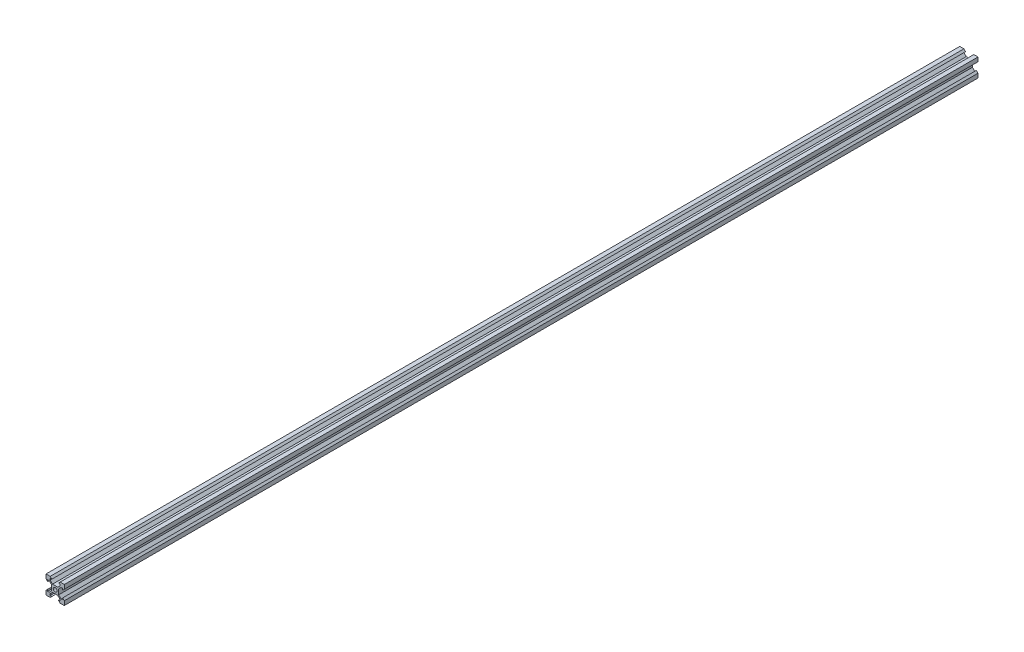
from build123d import *

# Parameters (mm, degrees)
BOSS_EXTRUDE1_DEPTH = 500
SKETCH2_R           = 2.1
CUT_EXTRUDE1_DEPTH  = 1001.099995


with BuildPart() as part:
    # Sketch1 → Boss-Extrude1 (new, symmetric)
    with BuildSketch(Plane.XY):
        Polygon((5.42, -10), (10, -10), (10, -5.42), (8.2, -3.62), (8.2, -5.5), (6.5606, -5.5), (3.9, -2.8394), (3.9, 0), (3.9, 2.8394), (6.5606, 5.5), (8.2, 5.5), (8.2, 3.62), (10, 5.42), (10, 10), (5.42, 10), (3.62, 8.2), (5.5, 8.2), (5.5, 6.5606), (2.8394, 3.9), (-2.8394, 3.9), (-5.5, 6.5606), (-5.5, 8.2), (-3.62, 8.2), (-5.42, 10), (-10, 10), (-10, 5.42), (-8.2, 3.62), (-8.2, 5.5), (-6.5606, 5.5), (-3.9, 2.8394), (-3.9, 0), (-3.9, -2.8394), (-6.5606, -5.5), (-8.2, -5.5), (-8.2, -3.62), (-10, -5.42), (-10, -10), (-5.42, -10), (-3.62, -8.2), (-5.5, -8.2), (-5.5, -6.5606), (-2.8394, -3.9), (2.8394, -3.9), (5.5, -6.5606), (5.5, -8.2), (3.62, -8.2), align=None)
    extrude(amount=BOSS_EXTRUDE1_DEPTH, both=True)

    # Sketch2 → Cut-Extrude1 (cut, through all)
    with BuildSketch(Plane.XY.offset(500)):
        Circle(SKETCH2_R)
    extrude(amount=-CUT_EXTRUDE1_DEPTH, mode=Mode.SUBTRACT)


solid = part.part
